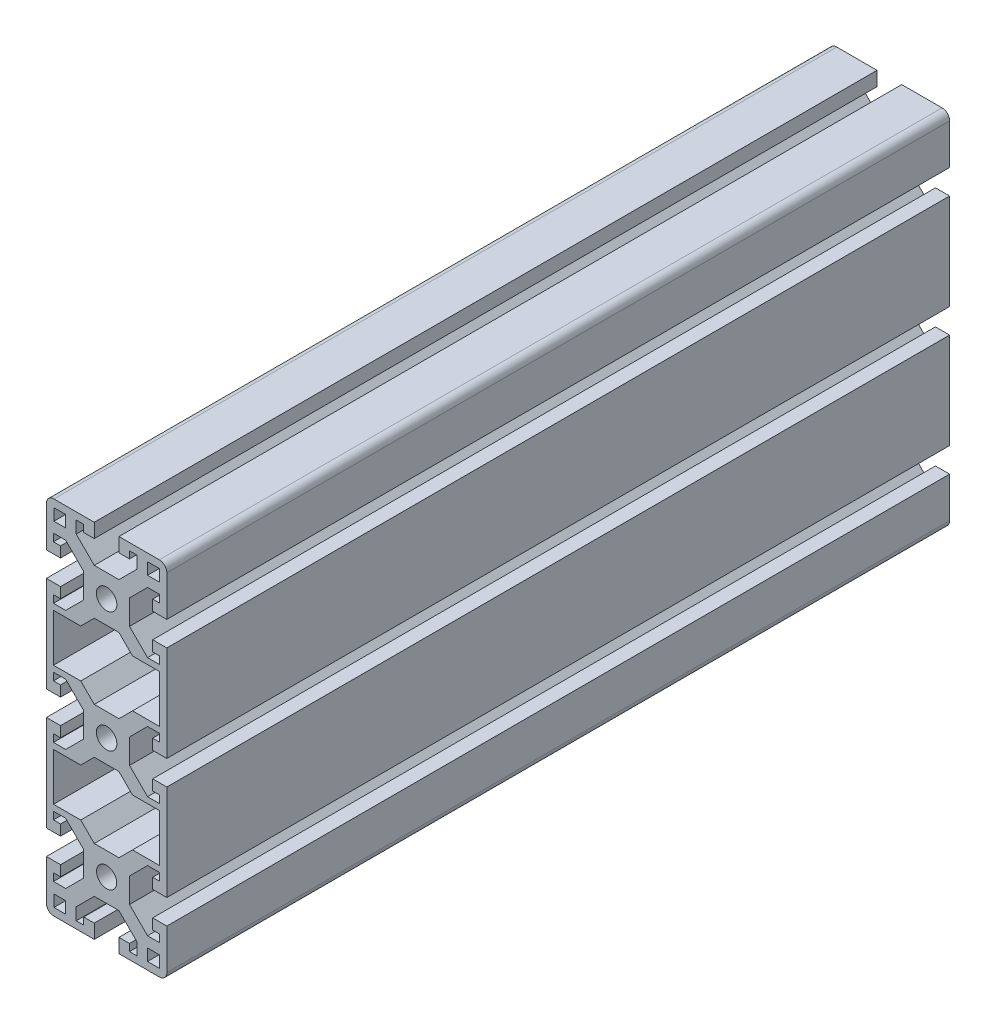
from build123d import *

# Parameters (mm, degrees)
SKETCH22_W                      = 3.9
SKETCH22_H                      = 3.9
F_40_SERIES_TS40_120LM_1_DEPTH  = 260
M8X1_25_TAPPED_HOLE1_AT_2_COUNT = 2
M8X1_25_TAPPED_HOLE1_AT_2_PITCH = 40


with BuildPart() as part:
    # Sketch22 → 40 series TS40-120LM(1) (new body)
    with BuildSketch(Plane(origin=(0, 0, 130), x_dir=(-1, 0, 0), z_dir=(0, 0, -1))):
        with BuildLine():
            Line((15.3, -35.9), (20, -35.9))
            Line((20, -35.9), (20, -4.1))
            Line((20, -4.1), (15.3, -4.1))
            Line((15.3, -4.1), (15.3, -7.6))
            Line((15.3, -7.6), (17.65, -7.6))
            Line((17.65, -7.6), (17.65, -10.1))
            Line((17.65, -10.1), (13.6, -10.1))
            Line((13.6, -10.1), (7.6, -4.1))
            Line((7.6, -4.1), (7.6, 4.1))
            Line((7.6, 4.1), (13.6, 10.1))
            Line((13.6, 10.1), (17.65, 10.1))
            Line((17.65, 10.1), (17.65, 7.6))
            Line((17.65, 7.6), (15.3, 7.6))
            Line((15.3, 7.6), (15.3, 4.1))
            Line((15.3, 4.1), (20, 4.1))
            Line((20, 4.1), (20, 35.9))
            Line((20, 35.9), (15.3, 35.9))
            Line((15.3, 35.9), (15.3, 32.4))
            Line((15.3, 32.4), (17.65, 32.4))
            Line((17.65, 32.4), (17.65, 29.9))
            Line((17.65, 29.9), (13.6, 29.9))
            Line((13.6, 29.9), (7.6, 35.9))
            Line((7.6, 35.9), (7.6, 44.1))
            Line((7.6, 44.1), (13.6, 50.1))
            Line((13.6, 50.1), (17.65, 50.1))
            Line((17.65, 50.1), (17.65, 47.6))
            Line((17.65, 47.6), (15.3, 47.6))
            Line((15.3, 47.6), (15.3, 44.1))
            Line((15.3, 44.1), (20, 44.1))
            Line((20, 44.1), (20, 57.5))
            ThreePointArc((20, 57.5), (19.267766953, 59.267766953), (17.5, 60))
            Line((17.5, 60), (4.1, 60))
            Line((4.1, 60), (4.1, 55.3))
            Line((4.1, 55.3), (7.6, 55.3))
            Line((7.6, 55.3), (7.6, 57.65))
            Line((7.6, 57.65), (10.1, 57.65))
            Line((10.1, 57.65), (10.1, 53.6))
            Line((10.1, 53.6), (4.1, 47.6))
            Line((4.1, 47.6), (-4.1, 47.6))
            Line((-4.1, 47.6), (-10.1, 53.6))
            Line((-10.1, 53.6), (-10.1, 57.65))
            Line((-10.1, 57.65), (-7.6, 57.65))
            Line((-7.6, 57.65), (-7.6, 55.3))
            Line((-7.6, 55.3), (-4.1, 55.3))
            Line((-4.1, 55.3), (-4.1, 60))
            Line((-4.1, 60), (-17.5, 60))
            ThreePointArc((-17.5, 60), (-19.267766953, 59.267766953), (-20, 57.5))
            Line((-20, 57.5), (-20, 44.1))
            Line((-20, 44.1), (-15.3, 44.1))
            Line((-15.3, 44.1), (-15.3, 47.6))
            Line((-15.3, 47.6), (-17.65, 47.6))
            Line((-17.65, 47.6), (-17.65, 50.1))
            Line((-17.65, 50.1), (-13.6, 50.1))
            Line((-13.6, 50.1), (-7.6, 44.1))
            Line((-7.6, 44.1), (-7.6, 35.9))
            Line((-7.6, 35.9), (-13.6, 29.9))
            Line((-13.6, 29.9), (-17.65, 29.9))
            Line((-17.65, 29.9), (-17.65, 32.4))
            Line((-17.65, 32.4), (-15.3, 32.4))
            Line((-15.3, 32.4), (-15.3, 35.9))
            Line((-15.3, 35.9), (-20, 35.9))
            Line((-20, 35.9), (-20, 4.1))
            Line((-20, 4.1), (-15.3, 4.1))
            Line((-15.3, 4.1), (-15.3, 7.6))
            Line((-15.3, 7.6), (-17.65, 7.6))
            Line((-17.65, 7.6), (-17.65, 10.1))
            Line((-17.65, 10.1), (-13.6, 10.1))
            Line((-13.6, 10.1), (-7.6, 4.1))
            Line((-7.6, 4.1), (-7.6, -4.1))
            Line((-7.6, -4.1), (-13.6, -10.1))
            Line((-13.6, -10.1), (-17.65, -10.1))
            Line((-17.65, -10.1), (-17.65, -7.6))
            Line((-17.65, -7.6), (-15.3, -7.6))
            Line((-15.3, -7.6), (-15.3, -4.1))
            Line((-15.3, -4.1), (-20, -4.1))
            Line((-20, -4.1), (-20, -35.9))
            Line((-20, -35.9), (-15.3, -35.9))
            Line((-15.3, -35.9), (-15.3, -32.4))
            Line((-15.3, -32.4), (-17.65, -32.4))
            Line((-17.65, -32.4), (-17.65, -29.9))
            Line((-17.65, -29.9), (-13.6, -29.9))
            Line((-13.6, -29.9), (-7.6, -35.9))
            Line((-7.6, -35.9), (-7.6, -44.1))
            Line((-7.6, -44.1), (-13.6, -50.1))
            Line((-13.6, -50.1), (-17.65, -50.1))
            Line((-17.65, -50.1), (-17.65, -47.6))
            Line((-17.65, -47.6), (-15.3, -47.6))
            Line((-15.3, -47.6), (-15.3, -44.1))
            Line((-15.3, -44.1), (-20, -44.1))
            Line((-20, -44.1), (-20, -57.5))
            ThreePointArc((-20, -57.5), (-19.267766953, -59.267766953), (-17.5, -60))
            Line((-17.5, -60), (-4.1, -60))
            Line((-4.1, -60), (-4.1, -55.3))
            Line((-4.1, -55.3), (-7.6, -55.3))
            Line((-7.6, -55.3), (-7.6, -57.65))
            Line((-7.6, -57.65), (-10.1, -57.65))
            Line((-10.1, -57.65), (-10.1, -53.6))
            Line((-10.1, -53.6), (-4.1, -47.6))
            Line((-4.1, -47.6), (4.1, -47.6))
            Line((4.1, -47.6), (10.1, -53.6))
            Line((10.1, -53.6), (10.1, -57.65))
            Line((10.1, -57.65), (7.6, -57.65))
            Line((7.6, -57.65), (7.6, -55.3))
            Line((7.6, -55.3), (4.1, -55.3))
            Line((4.1, -55.3), (4.1, -60))
            Line((4.1, -60), (17.5, -60))
            ThreePointArc((17.5, -60), (19.267766953, -59.267766953), (20, -57.5))
            Line((20, -57.5), (20, -44.1))
            Line((20, -44.1), (15.3, -44.1))
            Line((15.3, -44.1), (15.3, -47.6))
            Line((15.3, -47.6), (17.65, -47.6))
            Line((17.65, -47.6), (17.65, -50.1))
            Line((17.65, -50.1), (13.6, -50.1))
            Line((13.6, -50.1), (7.6, -44.1))
            Line((7.6, -44.1), (7.6, -35.9))
            Line((7.6, -35.9), (13.6, -29.9))
            Line((13.6, -29.9), (17.65, -29.9))
            Line((17.65, -29.9), (17.65, -32.4))
            Line((17.65, -32.4), (15.3, -32.4))
            Line((15.3, -32.4), (15.3, -35.9))
        make_face()
        Polygon((-4.1, -7.6), (4.1, -7.6), (8.6, -12.1), (17.65, -12.1), (17.65, -27.9), (8.6, -27.9), (4.1, -32.4), (-4.1, -32.4), (-8.6, -27.9), (-17.65, -27.9), (-17.65, -12.1), (-8.6, -12.1), align=None, mode=Mode.SUBTRACT)
        Polygon((-4.1, 7.6), (-8.6, 12.1), (-17.65, 12.1), (-17.65, 27.9), (-8.6, 27.9), (-4.1, 32.4), (4.1, 32.4), (8.6, 27.9), (17.65, 27.9), (17.65, 12.1), (8.6, 12.1), (4.1, 7.6), align=None, mode=Mode.SUBTRACT)
        with Locations((15.55, -55.55)):
            Rectangle(SKETCH22_W, SKETCH22_H, mode=Mode.SUBTRACT)
        with Locations((-15.55, -55.55)):
            Rectangle(SKETCH22_W, SKETCH22_H, mode=Mode.SUBTRACT)
        with Locations((-15.55, 55.55)):
            Rectangle(SKETCH22_W, SKETCH22_H, mode=Mode.SUBTRACT)
        with Locations((15.55, 55.55)):
            Rectangle(SKETCH22_W, SKETCH22_H, mode=Mode.SUBTRACT)
        with BuildLine():
            ThreePointArc((0, -43.35), (3.35, -40), (0, -36.65))
            ThreePointArc((0, -36.65), (-3.35, -40), (0, -43.35))
        make_face(mode=Mode.SUBTRACT)
        with BuildLine():
            ThreePointArc((3.35, 0), (0, -3.35), (-3.35, 0))
            ThreePointArc((-3.35, 0), (0, 3.35), (3.35, 0))
        make_face(mode=Mode.SUBTRACT)
        with BuildLine():
            ThreePointArc((0, 43.35), (-3.35, 40), (0, 36.65))
            ThreePointArc((0, 36.65), (3.35, 40), (0, 43.35))
        make_face(mode=Mode.SUBTRACT)
    extrude(amount=F_40_SERIES_TS40_120LM_1_DEPTH)

    # Sketch4 → M8x1.25 Tapped Hole1 (revolve, cut)
    with BuildSketch(Plane(origin=(0, 0, 130), x_dir=(0, -1, 0), z_dir=(1, 0, 0))):
        Polygon((0, 0), (0, 32.042926105), (3.4, 30), (3.4, 0), align=None)
    m8x1_25_tapped_hole1 = revolve(axis=Axis((0, 0, 136.35), (0, 0, -1)), mode=Mode.SUBTRACT)

    # M8x1.25 Tapped Hole1 at 2: M8x1.25 Tapped Hole1 ×2
    with Locations(*[(0, i * M8X1_25_TAPPED_HOLE1_AT_2_PITCH, 0) for i in range(1, M8X1_25_TAPPED_HOLE1_AT_2_COUNT)]):
        add(m8x1_25_tapped_hole1, mode=Mode.SUBTRACT)

    # Mirror1: M8x1.25 Tapped Hole1 across plane
    add(m8x1_25_tapped_hole1.mirror(Plane.XY), mode=Mode.SUBTRACT)

    # Mirror1 copy 1 sketch → Mirror1 copy 1 (revolve, cut)
    with BuildSketch(Plane(origin=(0, 40, -130), x_dir=(0, -1, 0), z_dir=(1, 0, 0))):
        Polygon((0, 0), (0, -32.042926105), (3.4, -30), (3.4, 0), align=None)
    revolve(axis=Axis((0, 40, -136.35), (0, 0, -1)), mode=Mode.SUBTRACT)


solid = part.part
